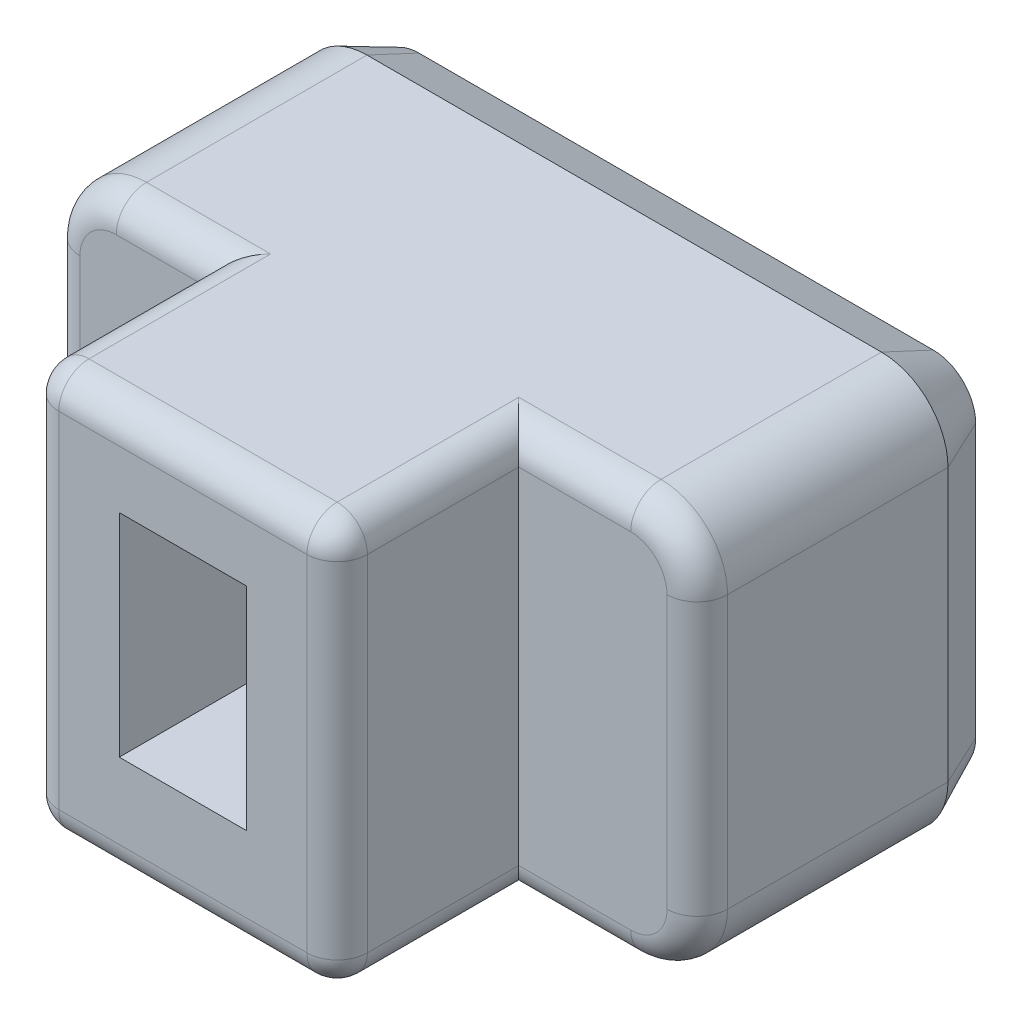
from build123d import *

# Parameters (mm, degrees)
BOSS_EXTRU_1_DEPTH      = 8
ESQUISSE3_W             = 2.1
ESQUISSE3_H             = 3.5
ENL_V_MAT_EXTRU_1_DEPTH = 3
ESQUISSE4_OUTSIDE_W     = 15.69
ESQUISSE4_OUTSIDE_H     = 11.69
ESQUISSE4_OUTSIDE_W_2   = 5.1
ESQUISSE4_OUTSIDE_H_2   = 6.7
ENL_V_MAT_EXTRU_2_DEPTH = 3
CONG_1_R                = 0.5
CHANFREIN1_SIZE         = 0.4
CHANFREIN1_SIZE2        = 0.857802768
ENL_V_MAT_EXTRU_3_DEPTH = 0.3
BOSS_EXTRU_2_START      = -0.2
BOSS_EXTRU_2_DEPTH      = 0.2
BOSS_EXTRU_2_2_DEPTH    = 0.2
BOSS_EXTRU_2_3_DEPTH    = 0.2


with BuildPart() as part:
    # Esquisse2 → Boss.-Extru.1 (new body)
    with BuildSketch(Plane.XY):
        with BuildLine():
            Line((1.1, 0), (9.6, 0))
            ThreePointArc((9.6, 0), (10.377817459, 0.322182541), (10.7, 1.1))
            Line((10.7, 1.1), (10.7, 5.6))
            ThreePointArc((10.7, 5.6), (10.377817459, 6.377817459), (9.6, 6.7))
            Line((9.6, 6.7), (1.1, 6.7))
            ThreePointArc((1.1, 6.7), (0.322182541, 6.377817459), (0, 5.6))
            Line((0, 5.6), (0, 1.1))
            ThreePointArc((0, 1.1), (0.322182541, 0.322182541), (1.1, 0))
        make_face()
    extrude(amount=BOSS_EXTRU_1_DEPTH)

    # Esquisse3 → Enlèv. mat.-Extru.1 (cut)
    with BuildSketch(Plane.XY.offset(8)):
        with Locations((5.2, 3.5)):
            Rectangle(ESQUISSE3_W, ESQUISSE3_H)
    extrude(amount=-ENL_V_MAT_EXTRU_1_DEPTH, mode=Mode.SUBTRACT)

    # Esquisse4 outside → Enlèv. mat.-Extru.2 (cut)
    with BuildSketch(Plane.XY.offset(8)):
        with Locations((5.35, 3.35)):
            Rectangle(ESQUISSE4_OUTSIDE_W, ESQUISSE4_OUTSIDE_H)
        with Locations((5.2, 3.35)):
            Rectangle(ESQUISSE4_OUTSIDE_W_2, ESQUISSE4_OUTSIDE_H_2, mode=Mode.SUBTRACT)
    extrude(amount=-ENL_V_MAT_EXTRU_2_DEPTH, mode=Mode.SUBTRACT)

    # Congé1
    cong_1_edges = [part.edges().sort_by_distance(p)[0] for p in [
        (8.675, 0, 5),
        (10.377817459, 0.322182541, 5),
        (10.7, 3.35, 5),
        (10.377817459, 6.377817459, 5),
        (1.875, 6.7, 5),
        (0.322182541, 6.377817459, 5),
        (1.875, 0, 5),
        (0.322182541, 0.322182541, 5),
        (7.75, 6.7, 6.5),
        (2.65, 6.7, 6.5),
        (7.75, 0, 6.5),
        (2.65, 0, 6.5),
        (2.65, 3.35, 8),
        (5.2, 6.7, 8),
        (7.75, 3.35, 8),
        (5.2, 0, 8),
        (8.675, 6.7, 5),
        (0, 3.35, 5),
    ]]
    fillet(cong_1_edges, radius=CONG_1_R)

    # Chanfrein1
    chanfrein1_edges = [part.edges().sort_by_distance(p)[0] for p in [
        (5.35, 0, 0),
        (10.377817459, 0.322182541, 0),
        (0.322182541, 0.322182541, 0),
        (10.7, 3.35, 0),
        (0, 3.35, 0),
        (10.377817459, 6.377817459, 0),
        (0.322182541, 6.377817459, 0),
        (5.35, 6.7, 0),
    ]]
    chanfrein1_side = [part.faces().sort_by_distance(p)[0] for p in [
        (5.35, 3.35, 0),
    ]]
    chamfer(chanfrein1_edges, length=CHANFREIN1_SIZE, length2=CHANFREIN1_SIZE2, reference=chanfrein1_side[0])

    # Esquisse5 → Enlèv. mat.-Extru.3 (cut)
    # profile 1 of 3: a face of its own
    with BuildSketch(Plane.XY.offset(0.2)):
        with BuildLine():
            Line((1.741567443, 1.356639893), (2.362561033, 1.356639893))
            add(Edge.make_bspline(
                [(2.362561033, 1.356639893), (2.403960264, 1.356813621), (2.483294207, 1.357146539), (2.597391731, 1.359104556), (2.700988429, 1.364479114), (2.794328725, 1.369222879), (2.876798989, 1.377804995), (2.949112238, 1.385906574), (3.010978892, 1.396817021), (3.048241848, 1.406636008), (3.065285392, 1.411127072)],
                knots=[0, 0, 0, 0, 1.406291012, 2.694895705, 3.875596585, 4.929939196, 5.86881668, 6.691431991, 7.401479668, 8, 8, 8, 8], degree=3))
            add(Edge.make_bspline(
                [(3.065285392, 1.411127072), (3.08788682, 1.418428314), (3.133136851, 1.433046038), (3.197748978, 1.46286216), (3.25913385, 1.498696692), (3.317959467, 1.539177196), (3.372452859, 1.587041789), (3.423849884, 1.640360733), (3.472881785, 1.69860091), (3.517742278, 1.763055522), (3.558228865, 1.832154913), (3.593825289, 1.9054881), (3.623363779, 1.983084396), (3.648284741, 2.064083165), (3.666572312, 2.149419581), (3.679929947, 2.238264035), (3.689388794, 2.331064541), (3.689983578, 2.394275862), (3.690285392, 2.426351431)],
                knots=[0, 0, 0, 0, 0.890159445, 1.782176851, 2.661847792, 3.553865198, 4.455671456, 5.376579952, 6.329510008, 7.307692435, 8.31786882, 9.330376746, 10.36095783, 11.428835377, 12.505555716, 13.63040485, 14.79758702, 16, 16, 16, 16], degree=3))
            add(Edge.make_bspline(
                [(3.690285392, 2.426351431), (3.689045836, 2.479585552), (3.686635843, 2.583085428), (3.663756669, 2.733381187), (3.626035553, 2.873658567), (3.574511114, 3.003826255), (3.508096847, 3.121306556), (3.428139696, 3.224172472), (3.335604179, 3.31220369), (3.247528908, 3.372432668), (3.169627886, 3.411355683), (3.106257503, 3.438398436), (3.036729571, 3.459383296), (2.962455976, 3.477967155), (2.882678006, 3.492294901), (2.797868922, 3.502502476), (2.707747256, 3.509042475), (2.645959358, 3.509995582), (2.614163597, 3.510486047)],
                knots=[0, 0, 0, 0, 1.4629789, 2.844381281, 4.168060411, 5.450008344, 6.683409462, 7.866022178, 9.019310308, 10.182424534, 10.783479041, 11.412251156, 12.074243506, 12.777826466, 13.516816875, 14.301129003, 15.125768982, 16, 16, 16, 16], degree=3))
            Line((2.614163597, 3.510486047), (3.741567443, 5.356639893))
            Line((3.741567443, 5.356639893), (3.34974052, 5.356639893))
            Line((3.34974052, 5.356639893), (2.222336674, 3.510486047))
            Line((2.222336674, 3.510486047), (2.049259751, 3.510486047))
            Line((2.049259751, 3.510486047), (2.049259751, 5.356639893))
            Line((2.049259751, 5.356639893), (1.741567443, 5.356639893))
            Line((1.741567443, 5.356639893), (1.741567443, 1.356639893))
        make_face()
        with BuildLine():
            Line((2.049259751, 1.766896303), (2.049259751, 3.100229636))
            Line((2.049259751, 3.100229636), (2.593330264, 3.105838611))
            add(Edge.make_bspline(
                [(2.593330264, 3.105838611), (2.642781834, 3.105003235), (2.734689158, 3.103450663), (2.862657655, 3.090161011), (2.970481612, 3.068473752), (3.059721411, 3.034902158), (3.134246878, 2.990811383), (3.197730073, 2.935370529), (3.254200597, 2.869723746), (3.299555874, 2.792739243), (3.336646344, 2.708571743), (3.362725809, 2.618549669), (3.379435706, 2.523655081), (3.381524855, 2.458741779), (3.382593084, 2.425550149)],
                knots=[0, 0, 0, 0, 1.484367149, 2.7587438, 3.858219379, 4.777130865, 5.607825064, 6.443728638, 7.29703089, 8.19649044, 9.115786766, 10.05213422, 11.004012465, 12, 12, 12, 12], degree=3))
            add(Edge.make_bspline(
                [(3.382593084, 2.425550149), (3.381491981, 2.393429835), (3.379321634, 2.330118533), (3.362844549, 2.237566534), (3.336426111, 2.149136382), (3.299107612, 2.066752424), (3.253078866, 1.992094465), (3.199009977, 1.928385397), (3.138983833, 1.875124486), (3.082661979, 1.839875137), (3.031725724, 1.818640345), (2.987934971, 1.804070943), (2.937833368, 1.793498225), (2.882513881, 1.783863762), (2.821590546, 1.775783408), (2.755006871, 1.770367626), (2.682572894, 1.767120369), (2.632329673, 1.766973058), (2.606150776, 1.766896303)],
                knots=[0, 0, 0, 0, 1.313137682, 2.588282835, 3.832400214, 5.079152676, 6.276491617, 7.408087164, 8.484055822, 9.548258813, 10.106251373, 10.738443295, 11.432799069, 12.197886161, 13.035284822, 13.945215938, 14.92936841, 16, 16, 16, 16], degree=3))
            Line((2.606150776, 1.766896303), (2.049259751, 1.766896303))
        make_face(mode=Mode.SUBTRACT)
    # profile 2 of 3: a face of its own
    with BuildSketch(Plane.XY.offset(0.2)):
        Polygon((4.356952058, 1.356639893), (6.151823853, 1.356639893), (6.151823853, 1.766896303), (4.664644366, 1.766896303), (4.664644366, 2.997665534), (6.151823853, 2.997665534), (6.151823853, 3.407921944), (4.664644366, 3.407921944), (4.664644366, 4.946383482), (6.151823853, 4.946383482), (6.151823853, 5.356639893), (4.356952058, 5.356639893), align=None)
    # profile 3 of 3: a face of its own
    with BuildSketch(Plane.XY.offset(0.2)):
        Polygon((6.459516161, 1.356639893), (6.794452058, 1.356639893), (7.81849052, 4.427953995), (8.842528981, 1.356639893), (9.177464879, 1.356639893), (7.844131546, 5.356639893), (7.792849494, 5.356639893), align=None)
    extrude(amount=-ENL_V_MAT_EXTRU_3_DEPTH, mode=Mode.SUBTRACT)


with BuildPart() as body_2:
    # Esquisse5<3> → Boss.-Extru.2 (new body)
    with BuildSketch(Plane.XY.offset(0.2).offset(BOSS_EXTRU_2_START)):
        with BuildLine():
            Line((1.741567443, 1.356639893), (2.362561033, 1.356639893))
            add(Edge.make_bspline(
                [(2.362561033, 1.356639893), (2.403960264, 1.356813621), (2.483294207, 1.357146539), (2.597391731, 1.359104556), (2.700988429, 1.364479114), (2.794328725, 1.369222879), (2.876798989, 1.377804995), (2.949112238, 1.385906574), (3.010978892, 1.396817021), (3.048241848, 1.406636008), (3.065285392, 1.411127072)],
                knots=[0, 0, 0, 0, 1.406291012, 2.694895705, 3.875596585, 4.929939196, 5.86881668, 6.691431991, 7.401479668, 8, 8, 8, 8], degree=3))
            add(Edge.make_bspline(
                [(3.065285392, 1.411127072), (3.08788682, 1.418428314), (3.133136851, 1.433046038), (3.197748978, 1.46286216), (3.25913385, 1.498696692), (3.317959467, 1.539177196), (3.372452859, 1.587041789), (3.423849884, 1.640360733), (3.472881785, 1.69860091), (3.517742278, 1.763055522), (3.558228865, 1.832154913), (3.593825289, 1.9054881), (3.623363779, 1.983084396), (3.648284741, 2.064083165), (3.666572312, 2.149419581), (3.679929947, 2.238264035), (3.689388794, 2.331064541), (3.689983578, 2.394275862), (3.690285392, 2.426351431)],
                knots=[0, 0, 0, 0, 0.890159445, 1.782176851, 2.661847792, 3.553865198, 4.455671456, 5.376579952, 6.329510008, 7.307692435, 8.31786882, 9.330376746, 10.36095783, 11.428835377, 12.505555716, 13.63040485, 14.79758702, 16, 16, 16, 16], degree=3))
            add(Edge.make_bspline(
                [(3.690285392, 2.426351431), (3.689045836, 2.479585552), (3.686635843, 2.583085428), (3.663756669, 2.733381187), (3.626035553, 2.873658567), (3.574511114, 3.003826255), (3.508096847, 3.121306556), (3.428139696, 3.224172472), (3.335604179, 3.31220369), (3.247528908, 3.372432668), (3.169627886, 3.411355683), (3.106257503, 3.438398436), (3.036729571, 3.459383296), (2.962455976, 3.477967155), (2.882678006, 3.492294901), (2.797868922, 3.502502476), (2.707747256, 3.509042475), (2.645959358, 3.509995582), (2.614163597, 3.510486047)],
                knots=[0, 0, 0, 0, 1.4629789, 2.844381281, 4.168060411, 5.450008344, 6.683409462, 7.866022178, 9.019310308, 10.182424534, 10.783479041, 11.412251156, 12.074243506, 12.777826466, 13.516816875, 14.301129003, 15.125768982, 16, 16, 16, 16], degree=3))
            Line((2.614163597, 3.510486047), (3.741567443, 5.356639893))
            Line((3.741567443, 5.356639893), (3.34974052, 5.356639893))
            Line((3.34974052, 5.356639893), (2.222336674, 3.510486047))
            Line((2.222336674, 3.510486047), (2.049259751, 3.510486047))
            Line((2.049259751, 3.510486047), (2.049259751, 5.356639893))
            Line((2.049259751, 5.356639893), (1.741567443, 5.356639893))
            Line((1.741567443, 5.356639893), (1.741567443, 1.356639893))
        make_face()
        with BuildLine():
            Line((2.049259751, 1.766896303), (2.049259751, 3.100229636))
            Line((2.049259751, 3.100229636), (2.593330264, 3.105838611))
            add(Edge.make_bspline(
                [(2.593330264, 3.105838611), (2.642781834, 3.105003235), (2.734689158, 3.103450663), (2.862657655, 3.090161011), (2.970481612, 3.068473752), (3.059721411, 3.034902158), (3.134246878, 2.990811383), (3.197730073, 2.935370529), (3.254200597, 2.869723746), (3.299555874, 2.792739243), (3.336646344, 2.708571743), (3.362725809, 2.618549669), (3.379435706, 2.523655081), (3.381524855, 2.458741779), (3.382593084, 2.425550149)],
                knots=[0, 0, 0, 0, 1.484367149, 2.7587438, 3.858219379, 4.777130865, 5.607825064, 6.443728638, 7.29703089, 8.19649044, 9.115786766, 10.05213422, 11.004012465, 12, 12, 12, 12], degree=3))
            add(Edge.make_bspline(
                [(3.382593084, 2.425550149), (3.381491981, 2.393429835), (3.379321634, 2.330118533), (3.362844549, 2.237566534), (3.336426111, 2.149136382), (3.299107612, 2.066752424), (3.253078866, 1.992094465), (3.199009977, 1.928385397), (3.138983833, 1.875124486), (3.082661979, 1.839875137), (3.031725724, 1.818640345), (2.987934971, 1.804070943), (2.937833368, 1.793498225), (2.882513881, 1.783863762), (2.821590546, 1.775783408), (2.755006871, 1.770367626), (2.682572894, 1.767120369), (2.632329673, 1.766973058), (2.606150776, 1.766896303)],
                knots=[0, 0, 0, 0, 1.313137682, 2.588282835, 3.832400214, 5.079152676, 6.276491617, 7.408087164, 8.484055822, 9.548258813, 10.106251373, 10.738443295, 11.432799069, 12.197886161, 13.035284822, 13.945215938, 14.92936841, 16, 16, 16, 16], degree=3))
            Line((2.606150776, 1.766896303), (2.049259751, 1.766896303))
        make_face(mode=Mode.SUBTRACT)
    extrude(amount=-BOSS_EXTRU_2_DEPTH)


with BuildPart() as body_3:
    # Esquisse5<3> → Boss.-Extru.2 2 (new body)
    with BuildSketch(Plane.XY.offset(0.2).offset(BOSS_EXTRU_2_START)):
        Polygon((4.356952058, 1.356639893), (6.151823853, 1.356639893), (6.151823853, 1.766896303), (4.664644366, 1.766896303), (4.664644366, 2.997665534), (6.151823853, 2.997665534), (6.151823853, 3.407921944), (4.664644366, 3.407921944), (4.664644366, 4.946383482), (6.151823853, 4.946383482), (6.151823853, 5.356639893), (4.356952058, 5.356639893), align=None)
    extrude(amount=-BOSS_EXTRU_2_2_DEPTH)


with BuildPart() as body_4:
    # Esquisse5<3> → Boss.-Extru.2 3 (new body)
    with BuildSketch(Plane.XY.offset(0.2).offset(BOSS_EXTRU_2_START)):
        Polygon((6.459516161, 1.356639893), (6.794452058, 1.356639893), (7.81849052, 4.427953995), (8.842528981, 1.356639893), (9.177464879, 1.356639893), (7.844131546, 5.356639893), (7.792849494, 5.356639893), align=None)
    extrude(amount=-BOSS_EXTRU_2_3_DEPTH)


solid = Compound([part.part, body_2.part, body_3.part, body_4.part])
